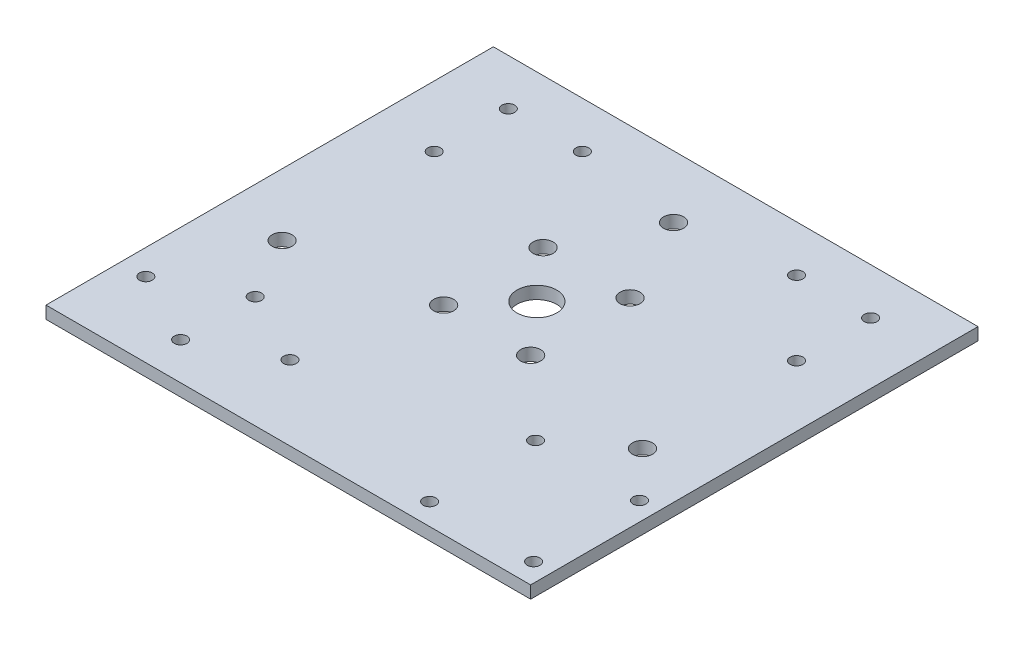
from build123d import *

# Parameters (mm, degrees)
SKETCH1_W                                     = 123.825
SKETCH1_H                                     = 114.3
PLATE_DEPTH                                   = 3.175
SKETCH2_R                                     = 5.08
FORCE_SENSOR_POST_HOLE_DEPTH                  = 85.317025453
GEARBOX_MOUNT_HOLES_4_CLEARANCE_D             = 3.2639
BEARING_MOUNT_HOLES_4_CLEARANCE_D             = 3.2639
BEARING_MOUNT_HOLES_4_CLEARANCE_DEPTH         = 7.62
BEARING_MOUNT_HOLES_4_CLEARANCE_TIP           = 0.980574487
FORCE_SENSOR_FOUNDATION_HOLES_10_CLEARA_D     = 5.1054
FORCE_SENSOR_FOUNDATION_HOLES_10_CLEARA_DEPTH = 7.62
FORCE_SENSOR_FOUNDATION_HOLES_10_CLEARA_TIP   = 1.533816902
BALL_CASTER_MOUNT_HOLES_4_CLEARANCE_D         = 3.2639
TOP_PLATE_GUIDE_HOLES_10_CLEARANCE_D          = 5.1054


with BuildPart() as part:
    # Sketch1 → Plate (new body)
    with BuildSketch(Plane(origin=(0, 0, 0), x_dir=(1, 0, 0), z_dir=(0, 1, 0))):
        Rectangle(SKETCH1_W, SKETCH1_H)
    extrude(amount=PLATE_DEPTH)

    # Sketch2 → Force Sensor Post Hole (cut, through all)
    with BuildSketch(Plane(origin=(0, 3.175, 0), x_dir=(1, 0, 0), z_dir=(0, 1, 0))):
        with Locations(Location((0, 6.35, 0), (0, 0, 270))):
            Circle(SKETCH2_R)
    extrude(amount=-FORCE_SENSOR_POST_HOLE_DEPTH, mode=Mode.SUBTRACT)

    # Gearbox Mount Holes (#4 clearance) (through all)
    with Locations(Plane(origin=(0, 3.175, 0), x_dir=(1, 0, 0), z_dir=(0, 1, 0))):
        with Locations((-55.4609, -38.1), (-37.0459, -28.575), (-18.6309, -38.1), (-37.0459, -47.625)):
            Hole(GEARBOX_MOUNT_HOLES_4_CLEARANCE_D / 2)

    # Bearing Mount Holes (#4 clearance)
    with Locations(Plane(origin=(0, 3.175, 0), x_dir=(1, 0, 0), z_dir=(0, 1, 0))):
        with Locations((57.15, -24.5745), (30.5816, -51.6255), (30.5816, -24.5745), (57.15, -51.6255)):
            Hole(BEARING_MOUNT_HOLES_4_CLEARANCE_D / 2, depth=BEARING_MOUNT_HOLES_4_CLEARANCE_DEPTH)
            with Locations((0, 0, -(BEARING_MOUNT_HOLES_4_CLEARANCE_DEPTH + BEARING_MOUNT_HOLES_4_CLEARANCE_TIP / 2))):  # 118° drill point
                Cone(0, BEARING_MOUNT_HOLES_4_CLEARANCE_D / 2, BEARING_MOUNT_HOLES_4_CLEARANCE_TIP, mode=Mode.SUBTRACT)

    # Force Sensor Foundation Holes (#10 clearance)
    with Locations(Plane(origin=(0, 3.175, 0), x_dir=(1, 0, 0), z_dir=(0, 1, 0))):
        with Locations((-11.1125, -6.35), (11.1125, 19.05), (-11.1125, 19.05), (11.1125, -6.35), (0, 6.35)):
            Hole(FORCE_SENSOR_FOUNDATION_HOLES_10_CLEARA_D / 2, depth=FORCE_SENSOR_FOUNDATION_HOLES_10_CLEARA_DEPTH)
            with Locations((0, 0, -(FORCE_SENSOR_FOUNDATION_HOLES_10_CLEARA_DEPTH + FORCE_SENSOR_FOUNDATION_HOLES_10_CLEARA_TIP / 2))):  # 118° drill point
                Cone(0, FORCE_SENSOR_FOUNDATION_HOLES_10_CLEARA_D / 2, FORCE_SENSOR_FOUNDATION_HOLES_10_CLEARA_TIP, mode=Mode.SUBTRACT)

    # Ball Caster Mount Holes (#4 clearance) (through all)
    with Locations(Plane(origin=(0, 3.175, 0), x_dir=(1, 0, 0), z_dir=(0, 1, 0))):
        with Locations((-46.2915, 45.339), (-46.2915, 26.416), (-27.3685, 45.339), (46.2915, 45.339), (46.2915, 26.416), (27.3685, 45.339)):
            Hole(BALL_CASTER_MOUNT_HOLES_4_CLEARANCE_D / 2)

    # Top Plate Guide Holes (#10 clearance) (through all)
    with Locations(Plane(origin=(0, 3.175, 0), x_dir=(1, 0, 0), z_dir=(0, 1, 0))):
        with Locations((-46.0375, -12.7), (46.0375, -12.7), (0, 41.275)):
            Hole(TOP_PLATE_GUIDE_HOLES_10_CLEARANCE_D / 2)


solid = part.part
